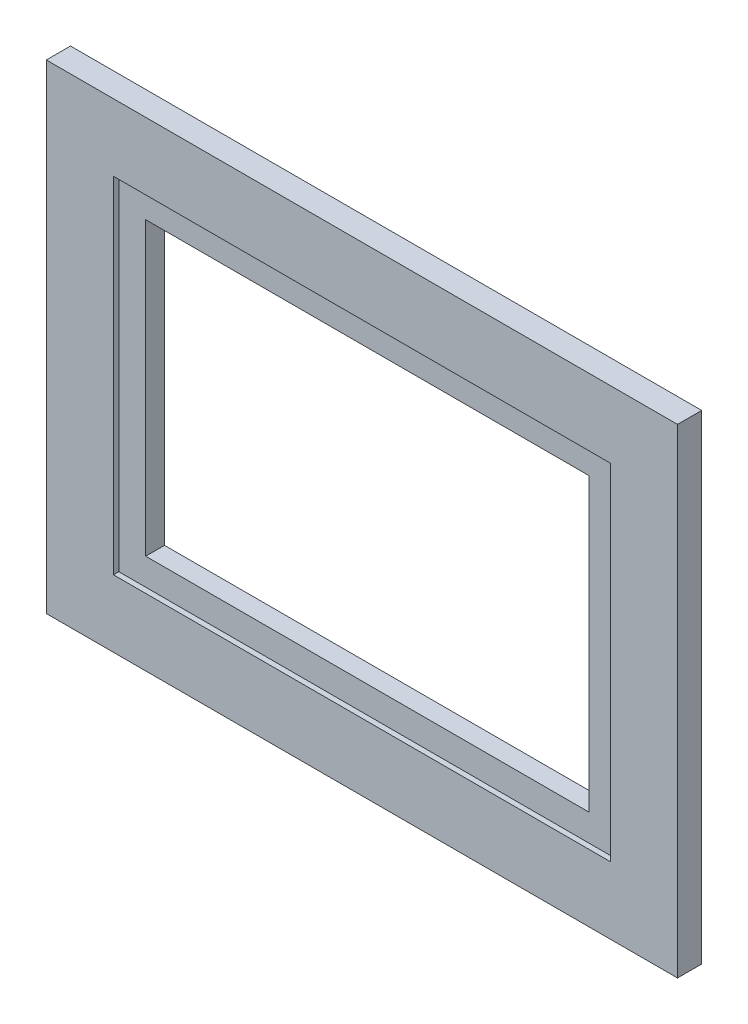
from build123d import *

# Parameters (mm, degrees)
SKETCH1_W           = 470
SKETCH1_H           = 357
BOSS_EXTRUDE1_DEPTH = 18
SKETCH3_W           = 370
SKETCH3_H           = 257
CUT_EXTRUDE1_DEPTH  = 4
SKETCH4_W           = 330
SKETCH4_H           = 217
CUT_EXTRUDE2_DEPTH  = 591.376998197


with BuildPart() as part:
    # Sketch1 → Boss-Extrude1 (new body)
    with BuildSketch(Plane.XY):
        with Locations((235, 178.5)):
            Rectangle(SKETCH1_W, SKETCH1_H)
    extrude(amount=BOSS_EXTRUDE1_DEPTH)

    # Sketch3 → Cut-Extrude1 (cut)
    with BuildSketch(Plane.XY.offset(18)):
        with Locations((235, 178.5)):
            Rectangle(SKETCH3_W, SKETCH3_H)
    extrude(amount=-CUT_EXTRUDE1_DEPTH, mode=Mode.SUBTRACT)

    # Sketch4 → Cut-Extrude2 (cut, through all)
    with BuildSketch(Plane.XY.offset(14)):
        with Locations((235, 178.5)):
            Rectangle(SKETCH4_W, SKETCH4_H)
    extrude(amount=-CUT_EXTRUDE2_DEPTH, mode=Mode.SUBTRACT)


solid = part.part
